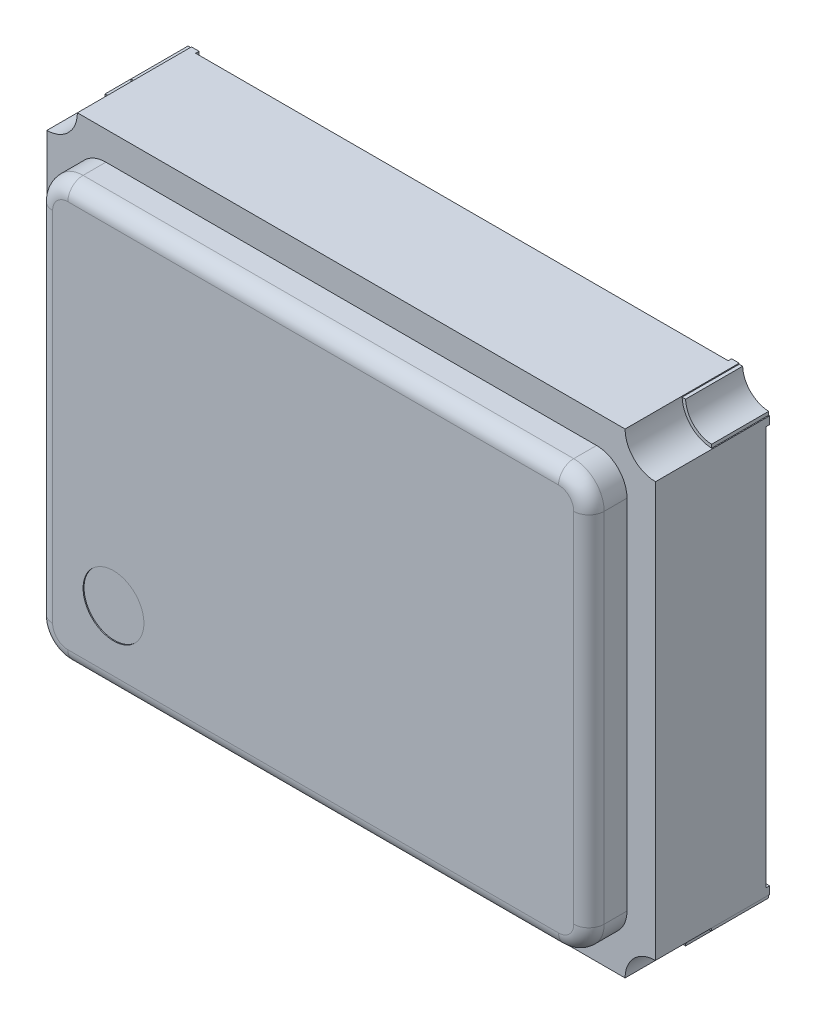
from build123d import *

# Parameters (mm, degrees)
SKETCH1_W               = 3.2
SKETCH1_H               = 2.5
BOSS_EXTRUDE1_DEPTH     = 0.564
SKETCH2_W               = 0.9
SKETCH2_H               = 0.7
BOSS_EXTRUDE2_DEPTH     = 0.018
CHAMFER2_SIZE           = 0.25
CUT_EXTRUDE1_DEPTH      = 3.10727217
CUT_EXTRUDE1_DEPTH_BACK = 3.10727217
BOSS_EXTRUDE3_START     = -0.282
BOSS_EXTRUDE3_DEPTH     = 0.3
MIRROR2_START           = -0.282
MIRROR2_COPY_1_DEPTH    = 0.3
BOSS_EXTRUDE4_START     = 0.018
BOSS_EXTRUDE4_DEPTH     = 0.018
SKETCH8_W               = 2.9
SKETCH8_H               = 2.2
BOSS_EXTRUDE5_DEPTH     = 0.2
FILLET1_R               = 0.16
FILLET2_R               = 0.08
SKETCH9_R               = 0.16
CUT_EXTRUDE2_DEPTH      = 0.005


with BuildPart() as part:
    # Sketch1 → Boss-Extrude1 (new body)
    with BuildSketch(Plane.XY):
        Rectangle(SKETCH1_W, SKETCH1_H)
    extrude(amount=BOSS_EXTRUDE1_DEPTH)

    # Sketch2 → Boss-Extrude2 (add)
    with BuildSketch(Plane(origin=(0, 0, 0), x_dir=(-1, 0, 0), z_dir=(0, 0, -1))):
        with Locations((1.05, -0.8)):
            Rectangle(SKETCH2_W, SKETCH2_H)
        Polygon((1.5, -1.05), (1.5, -1.15), (1.4, -1.15), (1.4, -1.25), (1.6, -1.25), (1.6, -1.05), align=None)
        with Locations((-1.05, -0.8)):
            Rectangle(SKETCH2_W, SKETCH2_H)
        Polygon((-1.6, -1.25), (-1.4, -1.25), (-1.4, -1.15), (-1.5, -1.15), (-1.5, -1.05), (-1.6, -1.05), align=None)
        Polygon((-1.6, 1.25), (-1.6, 1.05), (-1.5, 1.05), (-1.5, 1.15), (-1.4, 1.15), (-1.4, 1.25), align=None)
        with Locations((-1.05, 0.8)):
            Rectangle(SKETCH2_W, SKETCH2_H)
        with Locations((1.05, 0.8)):
            Rectangle(SKETCH2_W, SKETCH2_H)
        Polygon((1.5, 1.05), (1.6, 1.05), (1.6, 1.25), (1.4, 1.25), (1.4, 1.15), (1.5, 1.15), align=None)
    extrude(amount=BOSS_EXTRUDE2_DEPTH)

    # Chamfer2
    chamfer2_edges = [part.edges().sort_by_distance(p)[0] for p in [
        (-0.6, -0.45, -0.009),
    ]]
    chamfer(chamfer2_edges, length=CHAMFER2_SIZE)

    # Sketch3 → Cut-Extrude1 (cut, two sides: drawn at the far end of the back side and taken through both)
    with BuildSketch(Plane(origin=(0, 0, 0), x_dir=(-1, 0, 0), z_dir=(0, 0, -1)).offset(-CUT_EXTRUDE1_DEPTH_BACK)):
        with BuildLine():
            Line((1.6, 1.09), (1.6, 1.25))
            Line((1.6, 1.25), (1.44, 1.25))
            ThreePointArc((1.44, 1.25), (1.486862915, 1.136862915), (1.6, 1.09))
        make_face()
        with BuildLine():
            Line((-1.44, 1.25), (-1.6, 1.25))
            Line((-1.6, 1.25), (-1.6, 1.09))
            ThreePointArc((-1.6, 1.09), (-1.486862915, 1.136862915), (-1.44, 1.25))
        make_face()
        with BuildLine():
            Line((-1.6, -1.09), (-1.6, -1.25))
            Line((-1.6, -1.25), (-1.44, -1.25))
            ThreePointArc((-1.44, -1.25), (-1.486862915, -1.136862915), (-1.6, -1.09))
        make_face()
        with BuildLine():
            Line((1.6, -1.09), (1.6, -1.25))
            Line((1.6, -1.25), (1.44, -1.25))
            ThreePointArc((1.44, -1.25), (1.486862915, -1.136862915), (1.6, -1.09))
        make_face()
    extrude(amount=CUT_EXTRUDE1_DEPTH + CUT_EXTRUDE1_DEPTH_BACK, mode=Mode.SUBTRACT)

    # Sketch5 → Boss-Extrude3 (add)
    with BuildSketch(Plane(origin=(0, 0, 0), x_dir=(-1, 0, 0), z_dir=(0, 0, -1)).offset(BOSS_EXTRUDE3_START)):
        with BuildLine():
            Line((1.440078144, -1.245), (1.458088055, -1.245))
            ThreePointArc((1.458088055, -1.245), (1.499590837, -1.149590837), (1.595, -1.108088055))
            Line((1.595, -1.108088055), (1.595, -1.090078144))
            ThreePointArc((1.595, -1.090078144), (1.486862915, -1.136862915), (1.440078144, -1.245))
        make_face()
    boss_extrude3 = extrude(amount=BOSS_EXTRUDE3_DEPTH)

    # Mirror1: Boss-Extrude3 across plane
    add(boss_extrude3.mirror(Plane(origin=(0, 0, 0), x_dir=(0, 0, 1), z_dir=(1, 0, 0))))

    # Mirror2: Boss-Extrude3 across plane
    add(boss_extrude3.mirror(Plane.ZX))

    # Mirror2 copy 1 sketch → Mirror2 copy 1 (add)
    with BuildSketch(Plane(origin=(0, 0, 0), x_dir=(1, 0, 0), z_dir=(0, 0, -1)).offset(MIRROR2_START)):
        with BuildLine():
            Line((1.440078144, -1.245), (1.458088055, -1.245))
            ThreePointArc((1.458088055, -1.245), (1.499590837, -1.149590837), (1.595, -1.108088055))
            Line((1.595, -1.108088055), (1.595, -1.090078144))
            ThreePointArc((1.595, -1.090078144), (1.486862915, -1.136862915), (1.440078144, -1.245))
        make_face()
    extrude(amount=MIRROR2_COPY_1_DEPTH)

    # Sketch7 → Boss-Extrude4 (add)
    with BuildSketch(Plane.XY.offset(0.564).offset(BOSS_EXTRUDE4_START)):
        with BuildLine():
            Line((-1.44, 1.25), (1.44, 1.25))
            ThreePointArc((1.44, 1.25), (1.486862915, 1.136862915), (1.6, 1.09))
            Line((1.6, 1.09), (1.6, -1.09))
            ThreePointArc((1.6, -1.09), (1.486862915, -1.136862915), (1.44, -1.25))
            Line((1.44, -1.25), (-1.44, -1.25))
            ThreePointArc((-1.44, -1.25), (-1.486862915, -1.136862915), (-1.6, -1.09))
            Line((-1.6, -1.09), (-1.6, 1.09))
            ThreePointArc((-1.6, 1.09), (-1.486862915, 1.136862915), (-1.44, 1.25))
        make_face()
    extrude(amount=-BOSS_EXTRUDE4_DEPTH)

    # Sketch8 → Boss-Extrude5 (add)
    with BuildSketch(Plane.XY.offset(0.582)):
        Rectangle(SKETCH8_W, SKETCH8_H)
    extrude(amount=BOSS_EXTRUDE5_DEPTH)

    # Fillet1
    fillet1_edges = [part.edges().sort_by_distance(p)[0] for p in [
        (1.45, -1.1, 0.682),
        (1.45, 1.1, 0.682),
        (-1.45, 1.1, 0.682),
        (-1.45, -1.1, 0.682),
    ]]
    fillet(fillet1_edges, radius=FILLET1_R)

    # Fillet2
    fillet2_edges = [part.edges().sort_by_distance(p)[0] for p in [
        (-1.45, 0, 0.782),
        (0, 1.1, 0.782),
        (1.45, 0, 0.782),
        (0, -1.1, 0.782),
        (-1.403137085, -1.053137085, 0.782),
        (1.403137085, -1.053137085, 0.782),
        (1.403137085, 1.053137085, 0.782),
        (-1.403137085, 1.053137085, 0.782),
    ]]
    fillet(fillet2_edges, radius=FILLET2_R)

    # Sketch9 → Cut-Extrude2 (cut)
    with BuildSketch(Plane.XY.offset(0.782)):
        with Locations((-1.05, -0.7)):
            Circle(SKETCH9_R)
    extrude(amount=-CUT_EXTRUDE2_DEPTH, mode=Mode.SUBTRACT)


solid = part.part
